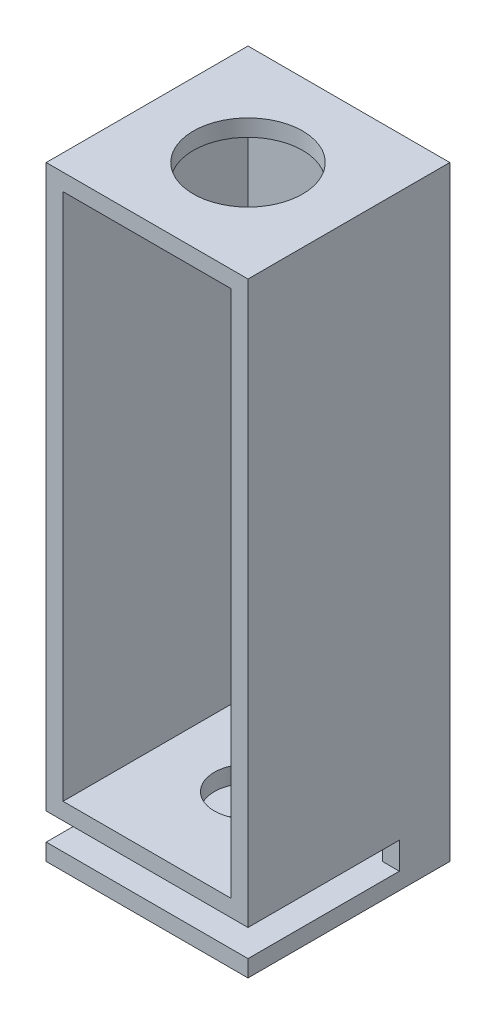
from build123d import *

# Parameters (mm, degrees)
CROQUIS1_W                 = 12
CROQUIS1_H                 = 12
SALIENTE_EXTRUIR1_DEPTH    = 36
VACIADO1_T                 = -1
CORTAR_EXTRUIR1_DEPTH      = 37.986484018
CORTAR_EXTRUIR1_DEPTH_BACK = 3
CROQUIS2_R                 = 3.25
CROQUIS3_W                 = 13.652855543
CROQUIS3_H                 = 1.6
CORTAR_EXTRUIR2_DEPTH      = 9
CROQUIS4_W                 = 10
CROQUIS4_H                 = 1
SALIENTE_EXTRUIR2_DEPTH    = 11
CROQUIS5_R                 = 2
CORTAR_EXTRUIR3_DEPTH      = 37.986484018


with BuildPart() as part:
    # Croquis1 → Saliente-Extruir1 (new body)
    with BuildSketch(Plane(origin=(0, 0, 0), x_dir=(1, 0, 0), z_dir=(0, 1, 0))):
        Rectangle(CROQUIS1_W, CROQUIS1_H)
    extrude(amount=SALIENTE_EXTRUIR1_DEPTH)

    # Vaciado1
    vaciado1_openings = [part.faces().sort_by_distance(p)[0] for p in [
        (0, 18, 6),
    ]]
    offset(amount=VACIADO1_T, openings=vaciado1_openings, kind=Kind.INTERSECTION)

    # Croquis2 → Cortar-Extruir1 (cut, two sides: drawn at the far end of the back side and taken through both)
    with BuildSketch(Plane(origin=(0, 36, 0), x_dir=(1, 0, 0), z_dir=(0, 1, 0)).offset(-CORTAR_EXTRUIR1_DEPTH_BACK)):
        with Locations(Location((0, 0, 0), (0, 0, 90))):
            Circle(CROQUIS2_R)
    extrude(amount=CORTAR_EXTRUIR1_DEPTH + CORTAR_EXTRUIR1_DEPTH_BACK, mode=Mode.SUBTRACT)

    # Croquis3 → Cortar-Extruir2 (cut)
    with BuildSketch(Plane.XY.offset(6)):
        with Locations((0.0537514, 1.8)):
            Rectangle(CROQUIS3_W, CROQUIS3_H)
    extrude(amount=-CORTAR_EXTRUIR2_DEPTH, mode=Mode.SUBTRACT)

    # Croquis4 → Saliente-Extruir2 (add)
    with BuildSketch(Plane.XY.offset(6)):
        with Locations((0, 3.1)):
            Rectangle(CROQUIS4_W, CROQUIS4_H)
    extrude(amount=-SALIENTE_EXTRUIR2_DEPTH)

    # Croquis5 → Cortar-Extruir3 (cut, through all)
    with BuildSketch(Plane(origin=(0, 36, 0), x_dir=(1, 0, 0), z_dir=(0, 1, 0))):
        with Locations(Location((0, 0, 0), (0, 0, 270))):
            Circle(CROQUIS5_R)
    extrude(amount=-CORTAR_EXTRUIR3_DEPTH, mode=Mode.SUBTRACT)


solid = part.part
